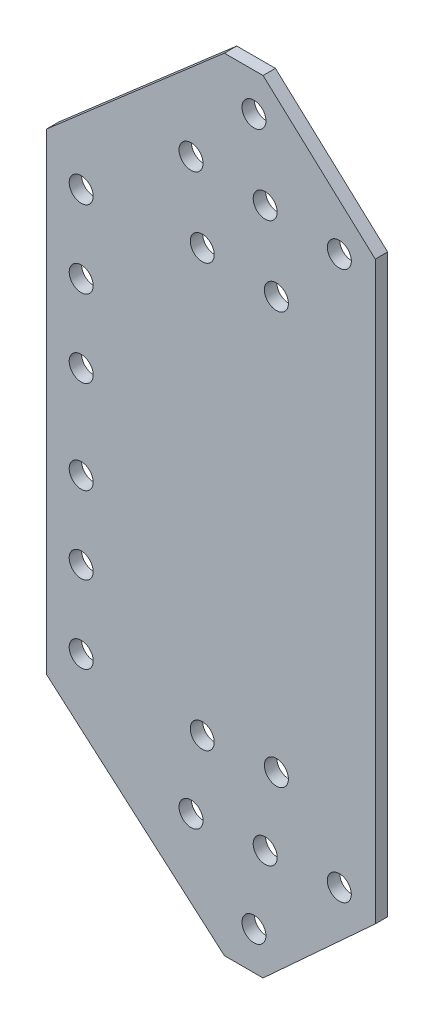
from build123d import *

# Parameters (mm, degrees)
EXTRUDE_1_DEPTH     = 16
SKETCH_2_R          = 15.5
CUT_EXTRUDE_2_DEPTH = 649.427486061


with BuildPart() as part:
    # 草图1 → 拉伸1 (new body)
    with BuildSketch(Plane.XY):
        Polygon((-395.537960369, 313.567840296), (-395.537960369, -296.432159704), (-165.537960369, -496.432159704), (-115.537960369, -496.432159704), (29.462039631, -363.432159704), (29.462039631, 380.567840296), (-115.537960369, 513.567840296), (-165.537960369, 513.567840296), align=None)
    extrude(amount=EXTRUDE_1_DEPTH)

    # 草图2 → 拉伸2 (cut, through all)
    with BuildSketch(Plane.XY.offset(16)):
        with Locations((-350.537960369, -51.432159704)):
            Circle(SKETCH_2_R)
        with Locations((-350.537960369, -251.432159704)):
            Circle(SKETCH_2_R)
        with Locations((-350.537960369, -151.432159704)):
            Circle(SKETCH_2_R)
        with Locations((-194.104974179, -264.23694972)):
            Circle(SKETCH_2_R)
        with Locations((-112.77894091, -352.475695817)):
            Circle(SKETCH_2_R)
        with Locations((-98.292741234, -257.527551975)):
            Circle(SKETCH_2_R)
        with Locations(Location((-208.591173855, -359.185093562, 0), (0, 0, 180))):
            Circle(SKETCH_2_R)
        with Locations((-127.265140586, -447.423839658)):
            Circle(SKETCH_2_R)
        with Locations(Location((-16.966707965, -345.766298072, 0), (0, 0, 180))):
            Circle(SKETCH_2_R)
        with Locations((-16.966707965, 362.901978664)):
            Circle(SKETCH_2_R)
        with Locations(Location((-127.265140586, 464.55952025, 0), (0, 0, 180))):
            Circle(SKETCH_2_R)
        with Locations((-208.591173855, 376.320774153)):
            Circle(SKETCH_2_R)
        with Locations(Location((-98.292741234, 274.663232567, 0), (0, 0, 180))):
            Circle(SKETCH_2_R)
        with Locations(Location((-112.77894091, 369.611376409, 0), (0, 0, 180))):
            Circle(SKETCH_2_R)
        with Locations(Location((-194.104974179, 281.372630312, 0), (0, 0, 180))):
            Circle(SKETCH_2_R)
        with Locations(Location((-350.537960369, 168.567840296, 0), (0, 0, 180))):
            Circle(SKETCH_2_R)
        with Locations(Location((-350.537960369, 268.567840296, 0), (0, 0, 180))):
            Circle(SKETCH_2_R)
        with Locations(Location((-350.537960369, 68.567840296, 0), (0, 0, 180))):
            Circle(SKETCH_2_R)
    extrude(amount=-CUT_EXTRUDE_2_DEPTH, mode=Mode.SUBTRACT)


solid = part.part
